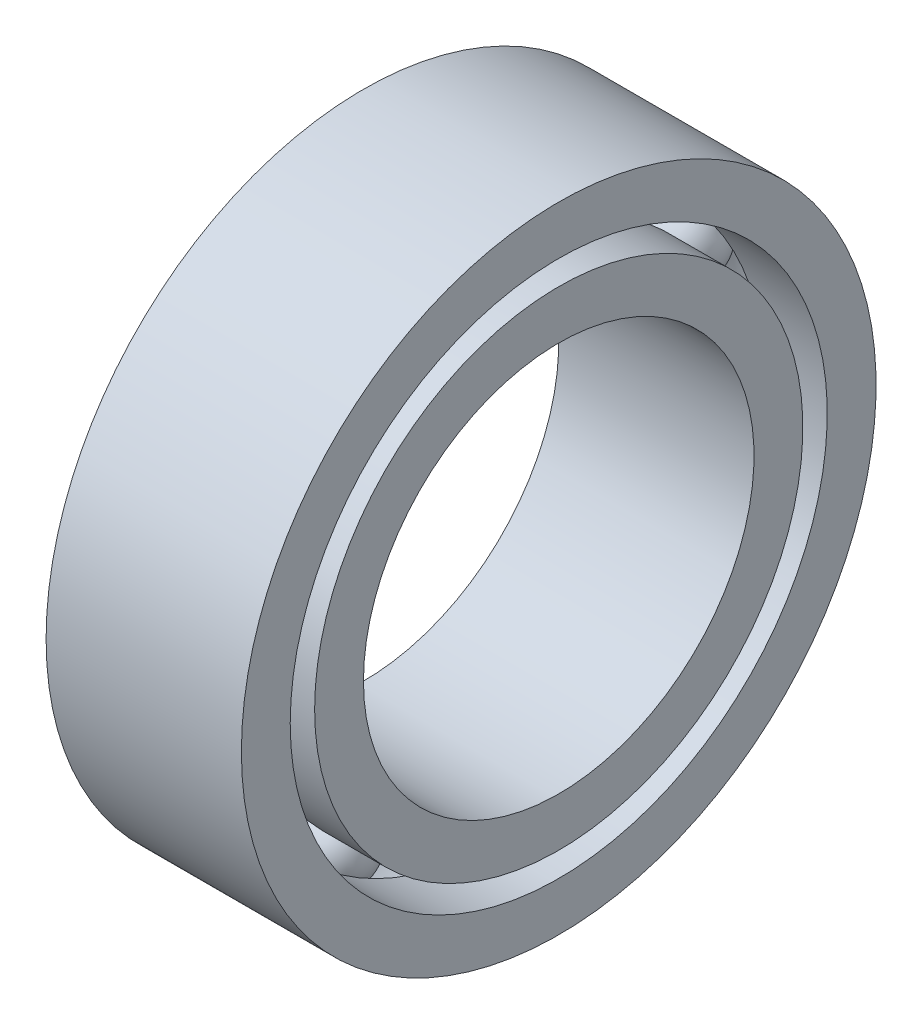
from build123d import *

# Parameters (mm, degrees)
CIRPATTERN6_COUNT = 12


with BuildPart() as part:
    # Sketch2 → Revolve3 (revolve)
    with BuildSketch(Plane.XY, mode=Mode.PRIVATE) as revolve3_sk:
        with BuildLine():
            Line((0.002997878, 6.5), (2.002997878, 6.5))
            Line((2.002997878, 6.5), (2.002997878, 5.5))
            Line((2.002997878, 5.5), (0.710104659, 5.5))
            ThreePointArc((0.710104659, 5.5), (0.002997878, 6), (-0.704108904, 5.5))
            Line((-0.704108904, 5.5), (-1.997002122, 5.5))
            Line((-1.997002122, 5.5), (-1.997002122, 6.5))
            Line((-1.997002122, 6.5), (0.002997878, 6.5))
        make_face()
        with BuildLine():
            Line((0.710104659, 5), (2.002997878, 5))
            Line((2.002997878, 5), (2.002997878, 4))
            Line((2.002997878, 4), (0.002997878, 4))
            Line((0.002997878, 4), (-1.997002122, 4))
            Line((-1.997002122, 4), (-1.997002122, 5))
            Line((-1.997002122, 5), (-0.704108904, 5))
            ThreePointArc((-0.704108904, 5), (0.002997878, 4.5), (0.710104659, 5))
        make_face()
    revolve(revolve3_sk.sketch.rotate(Axis((0, 0, 0), (1, 0, 0)), 90), axis=Axis((0, 0, 0), (1, 0, 0)))


with BuildPart() as body_2:
    # Sketch4 → Revolve4 (revolve)
    with BuildSketch(Plane.XY):
        with BuildLine():
            Line((-0.747002122, 5.25), (0.752997878, 5.25))
            ThreePointArc((0.752997878, 5.25), (0.002997878, 6), (-0.747002122, 5.25))
        make_face()
    revolve(axis=Axis((-0.747002122, 5.25, 0), (1, 0, 0)))


with BuildPart() as cirpattern6_1:
    # CirPattern6: pattern copy
    add(body_2.part.rotate(Axis((0, 0, 0), (1, 0, 0)), 1 * 360 / CIRPATTERN6_COUNT))


with BuildPart() as cirpattern6_2:
    # CirPattern6: pattern copy
    add(body_2.part.rotate(Axis((0, 0, 0), (1, 0, 0)), 2 * 360 / CIRPATTERN6_COUNT))


with BuildPart() as cirpattern6_3:
    # CirPattern6: pattern copy
    add(body_2.part.rotate(Axis((0, 0, 0), (1, 0, 0)), 3 * 360 / CIRPATTERN6_COUNT))


with BuildPart() as cirpattern6_4:
    # CirPattern6: pattern copy
    add(body_2.part.rotate(Axis((0, 0, 0), (1, 0, 0)), 4 * 360 / CIRPATTERN6_COUNT))


with BuildPart() as cirpattern6_5:
    # CirPattern6: pattern copy
    add(body_2.part.rotate(Axis((0, 0, 0), (1, 0, 0)), 5 * 360 / CIRPATTERN6_COUNT))


with BuildPart() as cirpattern6_6:
    # CirPattern6: pattern copy
    add(body_2.part.rotate(Axis((0, 0, 0), (1, 0, 0)), 6 * 360 / CIRPATTERN6_COUNT))


with BuildPart() as cirpattern6_7:
    # CirPattern6: pattern copy
    add(body_2.part.rotate(Axis((0, 0, 0), (1, 0, 0)), 7 * 360 / CIRPATTERN6_COUNT))


with BuildPart() as cirpattern6_8:
    # CirPattern6: pattern copy
    add(body_2.part.rotate(Axis((0, 0, 0), (1, 0, 0)), 8 * 360 / CIRPATTERN6_COUNT))


with BuildPart() as cirpattern6_9:
    # CirPattern6: pattern copy
    add(body_2.part.rotate(Axis((0, 0, 0), (1, 0, 0)), 9 * 360 / CIRPATTERN6_COUNT))


with BuildPart() as cirpattern6_10:
    # CirPattern6: pattern copy
    add(body_2.part.rotate(Axis((0, 0, 0), (1, 0, 0)), 10 * 360 / CIRPATTERN6_COUNT))


with BuildPart() as cirpattern6_11:
    # CirPattern6: pattern copy
    add(body_2.part.rotate(Axis((0, 0, 0), (1, 0, 0)), 11 * 360 / CIRPATTERN6_COUNT))


solid = Compound([part.part, body_2.part, cirpattern6_1.part, cirpattern6_2.part, cirpattern6_3.part, cirpattern6_4.part, cirpattern6_5.part, cirpattern6_6.part, cirpattern6_7.part, cirpattern6_8.part, cirpattern6_9.part, cirpattern6_10.part, cirpattern6_11.part])
